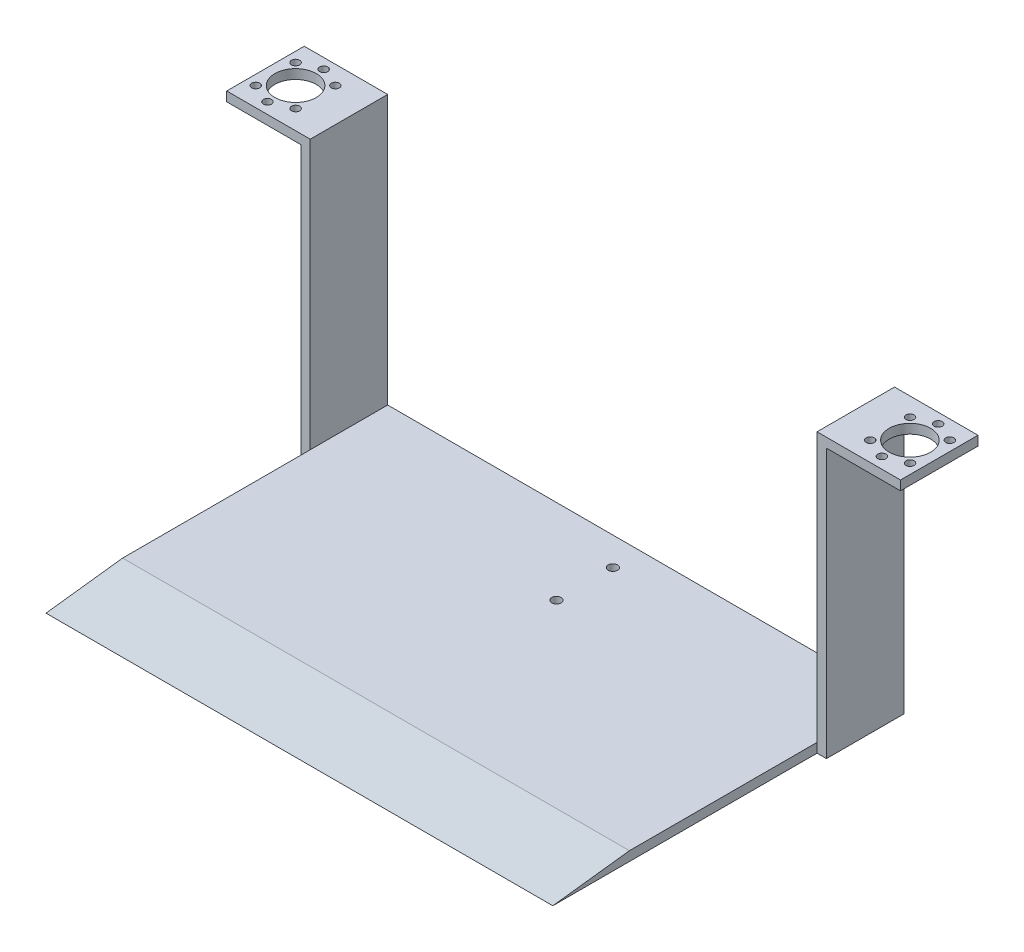
from build123d import *

# Parameters (mm, degrees)
SKETCH1_W           = 454.914
SKETCH1_H           = 381
BOSS_EXTRUDE1_DEPTH = 187.96
SKETCH3_W           = 50.0126
SKETCH3_H           = 202.0062
CUT_EXTRUDE1_DEPTH  = 623.444141266
SKETCH4_R           = 14
CUT_EXTRUDE2_DEPTH  = 623.444141266
SKETCH5_W           = 342.1888
SKETCH5_H           = 381
CUT_EXTRUDE3_DEPTH  = 181.61
SKETCH6_W           = 178.9938
SKETCH6_H           = 181.597400076
CUT_EXTRUDE4_DEPTH  = 50.0126
SKETCH7_W           = 178.9938
SKETCH7_H           = 181.597400076
CUT_EXTRUDE5_DEPTH  = 50.0126
SKETCH10_W          = 202.0062
SKETCH10_H          = 187.96
CUT_EXTRUDE6_DEPTH  = 587.885938937
SKETCH11_R          = 2.7499945
SKETCH11_R_2        = 2.75
CUT_EXTRUDE7_DEPTH  = 623.444141266
SKETCH12_R          = 2.75
CUT_EXTRUDE8_DEPTH  = 623.444141266
BOSS_EXTRUDE2_DEPTH = 342.1888
SKETCH15_W          = 56.3626
SKETCH15_H          = 126.6698
CUT_EXTRUDE9_DEPTH  = 623.444141266
SKETCH16_R          = 3.175
CUT_EXTRUDE10_DEPTH = 623.444141266


with BuildPart() as part:
    # Sketch1 → Boss-Extrude1 (new body)
    with BuildSketch(Plane(origin=(0, 0, 0), x_dir=(1, 0, 0), z_dir=(0, 1, 0))):
        with Locations((227.457, 190.5)):
            Rectangle(SKETCH1_W, SKETCH1_H)
    extrude(amount=BOSS_EXTRUDE1_DEPTH)

    # Sketch3 → Cut-Extrude1 (cut, through all)
    with BuildSketch(Plane(origin=(0, 187.96, 0), x_dir=(1, 0, 0), z_dir=(0, 1, 0))):
        with Locations((429.9077, 101.0031)):
            Rectangle(SKETCH3_W, SKETCH3_H)
        with Locations((25.0063, 101.0031)):
            Rectangle(SKETCH3_W, SKETCH3_H)
    extrude(amount=-CUT_EXTRUDE1_DEPTH, mode=Mode.SUBTRACT)

    # Sketch4 → Cut-Extrude2 (cut, through all)
    with BuildSketch(Plane(origin=(0, 187.96, 0), x_dir=(1, 0, 0), z_dir=(0, 1, 0))):
        with Locations(Location((20.066, 355.092, 0), (0, 0, 270))):
            Circle(SKETCH4_R)
        with Locations(Location((434.848, 355.092, 0), (0, 0, 270))):
            Circle(SKETCH4_R)
    extrude(amount=-CUT_EXTRUDE2_DEPTH, mode=Mode.SUBTRACT)

    # Sketch5 → Cut-Extrude3 (cut)
    with BuildSketch(Plane(origin=(0, 187.96, 0), x_dir=(1, 0, 0), z_dir=(0, 1, 0))):
        with Locations((227.457, 190.5)):
            Rectangle(SKETCH5_W, SKETCH5_H)
    extrude(amount=-CUT_EXTRUDE3_DEPTH, mode=Mode.SUBTRACT)

    # Sketch6 → Cut-Extrude4 (cut)
    with BuildSketch(Plane(origin=(454.914, 0, 0), x_dir=(0, 0, -1), z_dir=(1, 0, 0))):
        with Locations((291.5031, 90.798700038)):
            Rectangle(SKETCH6_W, SKETCH6_H)
    extrude(amount=-CUT_EXTRUDE4_DEPTH, mode=Mode.SUBTRACT)

    # Sketch7 → Cut-Extrude5 (cut)
    with BuildSketch(Plane.ZY):
        with Locations((-291.5031, 90.798700038)):
            Rectangle(SKETCH7_W, SKETCH7_H)
    extrude(amount=-CUT_EXTRUDE5_DEPTH, mode=Mode.SUBTRACT)

    # Sketch10 → Cut-Extrude6 (cut, through all)
    with BuildSketch(Plane(origin=(404.9014, 0, 0), x_dir=(0, 0, -1), z_dir=(1, 0, 0))):
        with Locations((101.0031, 93.98)):
            Rectangle(SKETCH10_W, SKETCH10_H)
    extrude(amount=-CUT_EXTRUDE6_DEPTH, mode=Mode.SUBTRACT)

    # Sketch11 → Cut-Extrude7 (cut, through all)
    with BuildSketch(Plane(origin=(0, 187.96, 0), x_dir=(1, 0, 0), z_dir=(0, 1, 0))):
        with Locations(Location((434.848, 374.174211985, 0), (0, 0, 270))):
            Circle(SKETCH11_R)
        with Locations(Location((448.283028843, 368.609240827, 0), (0, 0, 270))):
            Circle(SKETCH11_R_2)
        with Locations(Location((421.412971157, 368.609240827, 0), (0, 0, 270))):
            Circle(SKETCH11_R_2)
        with Locations(Location((448.283028843, 341.739183142, 0), (0, 0, 270))):
            Circle(SKETCH11_R_2)
        with Locations(Location((434.848, 336.174211985, 0), (0, 0, 270))):
            Circle(SKETCH11_R_2)
        with Locations(Location((421.412971157, 341.739183142, 0), (0, 0, 270))):
            Circle(SKETCH11_R_2)
    extrude(amount=-CUT_EXTRUDE7_DEPTH, mode=Mode.SUBTRACT)

    # Sketch12 → Cut-Extrude8 (cut, through all)
    with BuildSketch(Plane(origin=(0, 187.96, 0), x_dir=(1, 0, 0), z_dir=(0, 1, 0))):
        with Locations(Location((20.066, 374.092, 0), (0, 0, 270))):
            Circle(SKETCH12_R)
        with Locations(Location((6.630971157, 368.527028843, 0), (0, 0, 270))):
            Circle(SKETCH12_R)
        with Locations(Location((33.501028843, 368.527028843, 0), (0, 0, 270))):
            Circle(SKETCH12_R)
        with Locations(Location((33.501028843, 341.656971157, 0), (0, 0, 270))):
            Circle(SKETCH12_R)
        with Locations(Location((20.066, 336.092, 0), (0, 0, 270))):
            Circle(SKETCH12_R)
        with Locations(Location((6.630971157, 341.656971157, 0), (0, 0, 270))):
            Circle(SKETCH12_R)
    extrude(amount=-CUT_EXTRUDE8_DEPTH, mode=Mode.SUBTRACT)

    # Sketch13 → Boss-Extrude2 (add)
    with BuildSketch(Plane(origin=(398.5514, 0, 0), x_dir=(0, 0, -1), z_dir=(1, 0, 0))):
        Polygon((202.0062, 0), (150.289600182, 0), (202.0062, 6.35), align=None)
    extrude(amount=-BOSS_EXTRUDE2_DEPTH)

    # Sketch15 → Cut-Extrude9 (cut, through all)
    with BuildSketch(Plane(origin=(0, 187.96, 0), x_dir=(1, 0, 0), z_dir=(0, 1, 0))):
        with Locations((426.7327, 265.3411)):
            Rectangle(SKETCH15_W, SKETCH15_H)
        with Locations((28.1813, 265.3411)):
            Rectangle(SKETCH15_W, SKETCH15_H)
    extrude(amount=-CUT_EXTRUDE9_DEPTH, mode=Mode.SUBTRACT)

    # Sketch16 → Cut-Extrude10 (cut, through all)
    with BuildSketch(Plane.XZ):
        with Locations(Location((227.457, -361.95, 0), (0, 0, 270))):
            Circle(SKETCH16_R)
        with Locations(Location((227.457, -323.85, 0), (0, 0, 270))):
            Circle(SKETCH16_R)
    extrude(amount=-CUT_EXTRUDE10_DEPTH, mode=Mode.SUBTRACT)


solid = part.part
